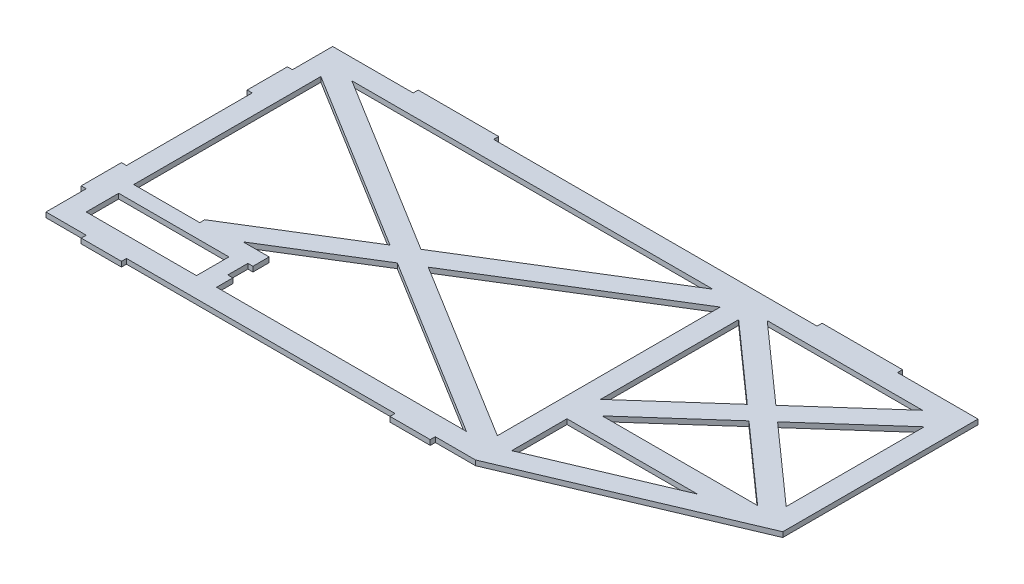
from build123d import *

# Parameters (mm, degrees)
SKETCH1_W           = 69.596
SKETCH1_H           = 20.4724
BOSS_EXTRUDE1_DEPTH = 3.175


with BuildPart() as part:
    # Sketch1 → Boss-Extrude1 (new body)
    with BuildSketch(Plane(origin=(0, 0, 0), x_dir=(1, 0, 0), z_dir=(0, 1, 0))):
        Polygon((272.33503015, 4.835931583), (136.08943015, -52.902160647), (110.68943015, -52.902160647), (110.68943015, -56.077160647), (85.28943015, -56.077160647), (85.28943015, -52.902160647), (-84.25556985, -52.902160647), (-84.25556985, -56.077160647), (-109.65556985, -56.077160647), (-109.65556985, -52.902160647), (-135.05556985, -52.902160647), (-135.05556985, -27.502160647), (-138.23056985, -27.502160647), (-138.23056985, -2.102160647), (-135.05556985, -2.102160647), (-135.05556985, 77.272839353), (-138.23056985, 77.272839353), (-138.23056985, 102.672839353), (-135.05556985, 102.672839353), (-135.05556985, 128.072839353), (-84.25556985, 128.072839353), (-84.25556985, 131.247839353), (-33.45556985, 131.247839353), (-33.45556985, 128.072839353), (136.08943015, 128.072839353), (170.73503015, 128.072839353), (170.73503015, 131.247839353), (221.53503015, 131.247839353), (221.53503015, 128.072839353), (272.33503015, 128.072839353), align=None)
        Polygon((201.03723015, 54.782902056), (250.077682757, 11.185931583), (151.996777543, 11.185931583), align=None, mode=Mode.SUBTRACT)
        Polygon((-56.511497321, -7.029760647), (-40.05956985, -7.029760647), (-40.05956985, -17.265960647), (-43.23456985, -17.265960647), (-43.23456985, -29.965960647), (-40.05956985, -29.965960647), (-40.05956985, -40.202160647), (117.648185377, -40.202160647), (3.69193015, 30.123488044), align=None, mode=Mode.SUBTRACT)
        Polygon((210.594577543, 63.279385468), (259.63503015, 19.682414995), (259.63503015, 106.87635594), align=None, mode=Mode.SUBTRACT)
        Polygon((142.43943015, -1.514068417), (142.43943015, -36.417831993), (224.802459945, -1.514068417), align=None, mode=Mode.SUBTRACT)
        Polygon((151.996777543, 115.372839353), (250.077682757, 115.372839353), (201.03723015, 71.77586888), align=None, mode=Mode.SUBTRACT)
        Polygon((142.43943015, 106.87635594), (142.43943015, 19.682414995), (191.479882757, 63.279385468), align=None, mode=Mode.SUBTRACT)
        Polygon((-110.264325076, 115.372839353), (117.648185377, 115.372839353), (3.69193015, 45.047190661), align=None, mode=Mode.SUBTRACT)
        Polygon((-122.35556985, 107.910988044), (-122.35556985, -7.029760647), (-122.35556985, -10.204760647), (-80.693986868, -10.204760647), (-80.693986868, -7.029760647), (-8.399314623, 37.585339353), align=None, mode=Mode.SUBTRACT)
        Polygon((129.73943015, 107.910988044), (129.73943015, -32.740309339), (15.783174924, 37.585339353), align=None, mode=Mode.SUBTRACT)
        with Locations((-87.55756985, -29.965960647)):
            Rectangle(SKETCH1_W, SKETCH1_H, mode=Mode.SUBTRACT)
    extrude(amount=BOSS_EXTRUDE1_DEPTH)


solid = part.part
